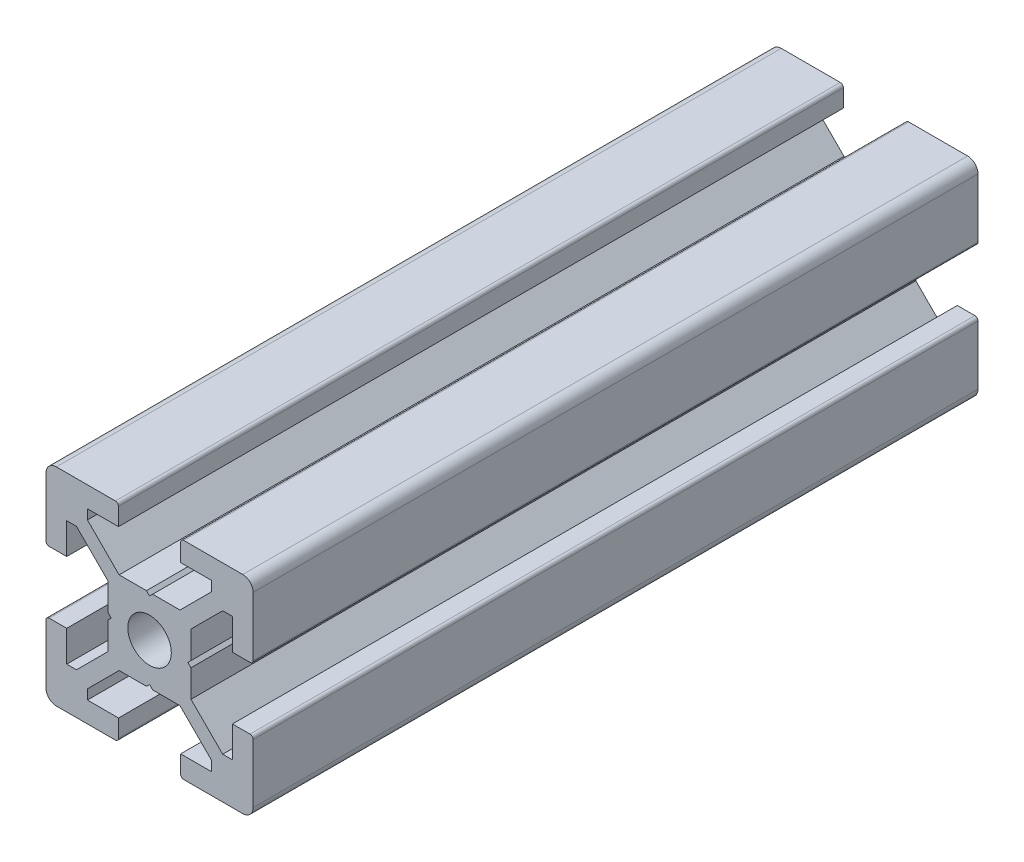
from build123d import *

# Parameters (mm, degrees)
SKETCH1_R           = 2.1
BOSS_EXTRUDE1_DEPTH = 35


with BuildPart() as part:
    # Sketch1 → Boss-Extrude1 (new, symmetric)
    with BuildSketch(Plane(origin=(0, 0, 0), x_dir=(-1, 0, 0), z_dir=(0, 0, -1))):
        with BuildLine():
            Line((10, 3.3), (10, 9))
            ThreePointArc((10, 9), (9.707106781, 9.707106781), (9, 10))
            Line((9, 10), (3.3, 10))
            ThreePointArc((3.3, 10), (3.087867966, 9.912132034), (3, 9.7))
            Line((3, 9.7), (3, 8))
            Line((3, 8), (6, 8))
            Line((6, 8), (6, 7.060660172))
            Line((6, 7.060660172), (2.939339828, 4))
            Line((2.939339828, 4), (0.3, 4))
            Line((0.3, 4), (0, 3.7))
            Line((0, 3.7), (-0.3, 4))
            Line((-0.3, 4), (-2.939339828, 4))
            Line((-2.939339828, 4), (-6, 7.060660172))
            Line((-6, 7.060660172), (-6, 8))
            Line((-6, 8), (-3, 8))
            Line((-3, 8), (-3, 9.7))
            ThreePointArc((-3, 9.7), (-3.087867966, 9.912132034), (-3.3, 10))
            Line((-3.3, 10), (-9, 10))
            ThreePointArc((-9, 10), (-9.707106781, 9.707106781), (-10, 9))
            Line((-10, 9), (-10, 3.3))
            ThreePointArc((-10, 3.3), (-9.912132034, 3.087867966), (-9.7, 3))
            Line((-9.7, 3), (-8, 3))
            Line((-8, 3), (-8, 6))
            Line((-8, 6), (-7.060660172, 6))
            Line((-7.060660172, 6), (-4, 2.939339828))
            Line((-4, 2.939339828), (-4, 0.3))
            Line((-4, 0.3), (-3.7, 0))
            Line((-3.7, 0), (-4, -0.3))
            Line((-4, -0.3), (-4, -2.939339828))
            Line((-4, -2.939339828), (-7.060660172, -6))
            Line((-7.060660172, -6), (-8, -6))
            Line((-8, -6), (-8, -3))
            Line((-8, -3), (-9.7, -3))
            ThreePointArc((-9.7, -3), (-9.912132034, -3.087867966), (-10, -3.3))
            Line((-10, -3.3), (-10, -9))
            ThreePointArc((-10, -9), (-9.707106781, -9.707106781), (-9, -10))
            Line((-9, -10), (-3.3, -10))
            ThreePointArc((-3.3, -10), (-3.087867966, -9.912132034), (-3, -9.7))
            Line((-3, -9.7), (-3, -8))
            Line((-3, -8), (-6, -8))
            Line((-6, -8), (-6, -7.060660172))
            Line((-6, -7.060660172), (-2.939339828, -4))
            Line((-2.939339828, -4), (-0.3, -4))
            Line((-0.3, -4), (0, -3.7))
            Line((0, -3.7), (0.3, -4))
            Line((0.3, -4), (2.939339828, -4))
            Line((2.939339828, -4), (6, -7.060660172))
            Line((6, -7.060660172), (6, -8))
            Line((6, -8), (3, -8))
            Line((3, -8), (3, -9.7))
            ThreePointArc((3, -9.7), (3.087867966, -9.912132034), (3.3, -10))
            Line((3.3, -10), (9, -10))
            ThreePointArc((9, -10), (9.707106781, -9.707106781), (10, -9))
            Line((10, -9), (10, -3.3))
            ThreePointArc((10, -3.3), (9.912132034, -3.087867966), (9.7, -3))
            Line((9.7, -3), (8, -3))
            Line((8, -3), (8, -6))
            Line((8, -6), (7.060660172, -6))
            Line((7.060660172, -6), (4, -2.939339828))
            Line((4, -2.939339828), (4, -0.3))
            Line((4, -0.3), (3.7, 0))
            Line((3.7, 0), (4, 0.3))
            Line((4, 0.3), (4, 2.939339828))
            Line((4, 2.939339828), (7.060660172, 6))
            Line((7.060660172, 6), (8, 6))
            Line((8, 6), (8, 3))
            Line((8, 3), (9.7, 3))
            ThreePointArc((9.7, 3), (9.912132034, 3.087867966), (10, 3.3))
        make_face()
        Circle(SKETCH1_R, mode=Mode.SUBTRACT)
    extrude(amount=BOSS_EXTRUDE1_DEPTH, both=True)


solid = part.part
